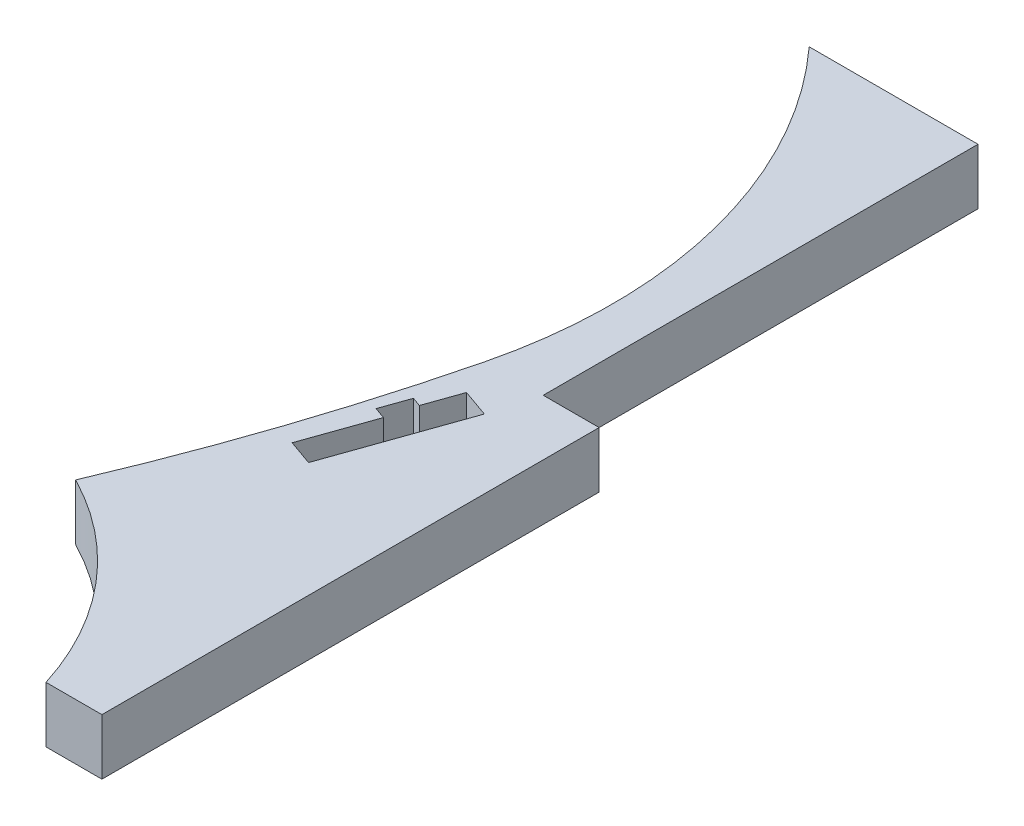
from build123d import *

# Parameters (mm, degrees)
BOSS_EXTRUDE1_DEPTH              = 19.05
CUT_EXTRUDE2_DEPTH               = 328.154074659
F_1_8_0_125_DIAMETER_HOLE1_D     = 3.175
F_1_8_0_125_DIAMETER_HOLE1_DEPTH = 11.1252
F_1_8_0_125_DIAMETER_HOLE1_TIP   = 0.953866233


with BuildPart() as part:
    # Sketch1 → Boss-Extrude1 (new body)
    with BuildSketch(Plane(origin=(0, 0, 0), x_dir=(1, 0, 0), z_dir=(0, 1, 0))):
        with BuildLine():
            Line((0, 169.388632852), (0, 0))
            Line((0, 0), (-19.05, 0))
            ThreePointArc((-19.05, 0), (-39.88804557, 37.868270719), (-73.722410895, 64.765590165))
            ThreePointArc((-73.722410895, 64.765590165), (-54.193392954, 116.375662835), (-38.876501861, 169.388632852))
            ThreePointArc((-38.876501861, 169.388632852), (-39.194658591, 248.155900408), (-76.554791267, 317.5))
            Line((-76.554791267, 317.5), (-19.05, 317.5))
            Line((-19.05, 317.5), (-19.05, 169.388632852))
            Line((-19.05, 169.388632852), (0, 169.388632852))
        make_face()
    extrude(amount=BOSS_EXTRUDE1_DEPTH)

    # Sketch2 → Cut-Extrude2 (cut, through all)
    with BuildSketch(Plane(origin=(0, 19.05, 0), x_dir=(1, 0, 0), z_dir=(0, 1, 0))):
        Polygon((-39.164098049, 109.561842364), (-23.543572116, 153.825683885), (-32.944847981, 157.143355113), (-37.133143759, 145.274992843), (-40.27089443, 146.38229203), (-43.588565658, 136.981016166), (-39.696317688, 135.607458014), (-47.810876614, 112.613254626), align=None)
    extrude(amount=-CUT_EXTRUDE2_DEPTH, mode=Mode.SUBTRACT)

    # 1/8 (0.125) Diameter Hole1
    with Locations(Plane(origin=(0, 0, 0), x_dir=(-1, 0, 0), z_dir=(0, -1, 0))):
        with Locations((12.7, 28.575), (38.363219465, 73.025), (38.363219465, 300.0375)):
            Hole(F_1_8_0_125_DIAMETER_HOLE1_D / 2, depth=F_1_8_0_125_DIAMETER_HOLE1_DEPTH)
            with Locations((0, 0, -(F_1_8_0_125_DIAMETER_HOLE1_DEPTH + F_1_8_0_125_DIAMETER_HOLE1_TIP / 2))):  # 118° drill point
                Cone(0, F_1_8_0_125_DIAMETER_HOLE1_D / 2, F_1_8_0_125_DIAMETER_HOLE1_TIP, mode=Mode.SUBTRACT)


solid = part.part
